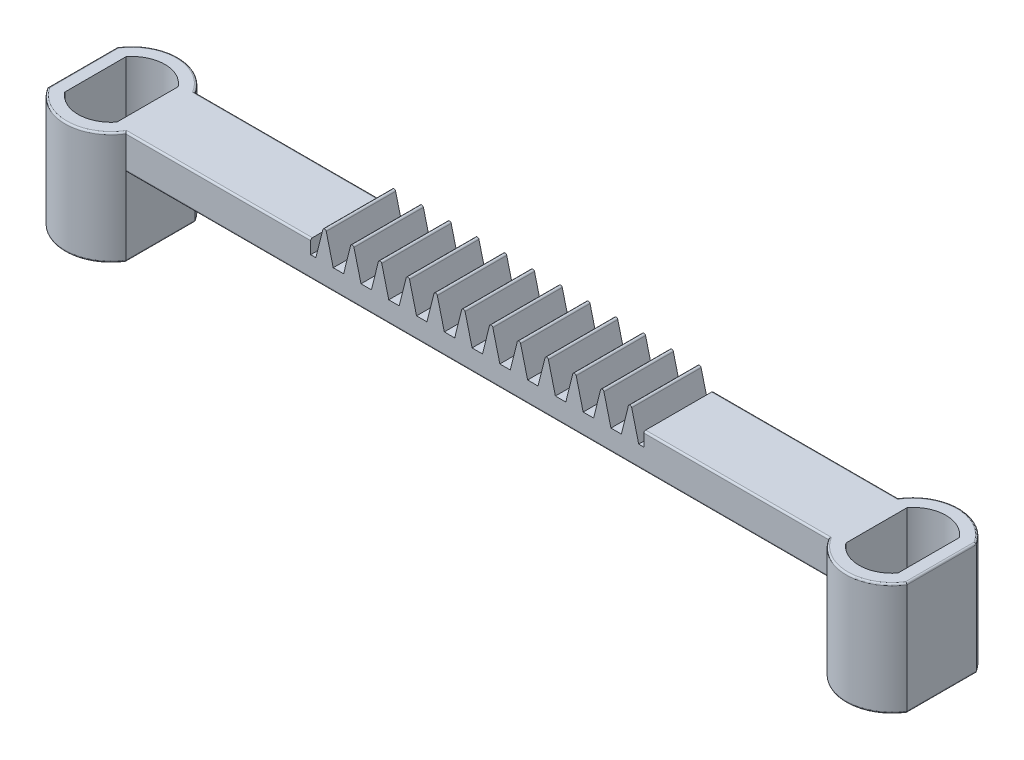
from build123d import *

# Parameters (mm, degrees)
SKETCH_1_W                     = 42
SKETCH_1_H                     = 4
EXTRUDE_1_DEPTH                = 2
EXTRUDE_2_DEPTH                = 6.5
CUT_EXTRUDE_1_DEPTH            = 5
CUT_EXTRUDE_2_DEPTH            = 1.5
CUT_EXTRUDE_3_REACH            = 27.698
SKETCH_5_W                     = 19.2
SKETCH_5_H                     = 0.8
EXTRUDE_3_DEPTH                = 4
FILLET_1_R                     = 0.1
PATTERN_LINEAR_1_COUNT         = 12
PATTERN_LINEAR_1_PITCH         = 1.6
FILLET_1_OF_PATTERN_LINEAR_1_R = 0.1
FILLET_2_R                     = 0.1


with BuildPart() as part:
    # 草图1 → 凸台-拉伸1 (new body)
    with BuildSketch(Plane(origin=(0, 0, 0), x_dir=(1, 0, 0), z_dir=(0, 1, 0))):
        Rectangle(SKETCH_1_W, SKETCH_1_H)
    extrude(amount=EXTRUDE_1_DEPTH)

    # 草图2 → 凸台-拉伸2 (add)
    with BuildSketch(Plane(origin=(0, 2, 0), x_dir=(1, 0, 0), z_dir=(0, 1, 0))):
        with BuildLine():
            Line((20.25, 2), (20.25, -2))
            ThreePointArc((20.25, -2), (22.5, -3.25), (24.75, -2))
            Line((24.75, -2), (24.75, 2))
            ThreePointArc((24.75, 2), (22.5, 3.25), (20.25, 2))
        make_face()
    extrude_2 = extrude(amount=-EXTRUDE_2_DEPTH)

    # 草图3 → 切除-拉伸1 (cut)
    with BuildSketch(Plane(origin=(0, 2, 0), x_dir=(1, 0, 0), z_dir=(0, 1, 0))):
        with BuildLine():
            Line((21, 1.766190379), (21, -1.766190379))
            ThreePointArc((21, -1.766190379), (22.5, -2.5), (24, -1.766190379))
            Line((24, -1.766190379), (24, 1.766190379))
            ThreePointArc((24, 1.766190379), (22.5, 2.5), (21, 1.766190379))
        make_face()
    cut_extrude_1 = extrude(amount=-CUT_EXTRUDE_1_DEPTH, mode=Mode.SUBTRACT)

    # 草图4 → 切除-拉伸2 (cut)
    with BuildSketch(Plane.XZ.offset(4.5)):
        with BuildLine():
            Line((23.75, -1.677032961), (23.75, 1.677032961))
            ThreePointArc((23.75, 1.677032961), (22.5, 2.25), (21.25, 1.677032961))
            Line((21.25, 1.677032961), (21.25, -1.677032961))
            ThreePointArc((21.25, -1.677032961), (22.5, -2.25), (23.75, -1.677032961))
        make_face()
    cut_extrude_2 = extrude(amount=-CUT_EXTRUDE_2_DEPTH, mode=Mode.SUBTRACT)

    # 镜向1: 凸台-拉伸2, 切除-拉伸1, 切除-拉伸2 across plane
    add(extrude_2.mirror(Plane(origin=(0, 0, 0), x_dir=(0, 0, 1), z_dir=(1, 0, 0))))
    add(cut_extrude_1.mirror(Plane(origin=(0, 0, 0), x_dir=(0, 0, 1), z_dir=(1, 0, 0))), mode=Mode.SUBTRACT)
    add(cut_extrude_2.mirror(Plane(origin=(0, 0, 0), x_dir=(0, 0, 1), z_dir=(1, 0, 0))), mode=Mode.SUBTRACT)

    # 草图5 → 切除-拉伸3 (cut, up to next)
    with BuildSketch(Plane.XY.offset(2), mode=Mode.PRIVATE) as cut_extrude_3_sk1:
        with Locations((0, 1.6)):
            Rectangle(SKETCH_5_W, SKETCH_5_H)
    cut_extrude_3_tool1 = extrude(cut_extrude_3_sk1.sketch, amount=-CUT_EXTRUDE_3_REACH, mode=Mode.PRIVATE) & part.part
    add(cut_extrude_3_tool1.solids().sort_by_distance((0, 1.6, 2))[0], mode=Mode.SUBTRACT)

    # 草图6 → 凸台-拉伸3 (add)
    with BuildSketch(Plane.XY.offset(2)):
        Polygon((-9.3, 1.2), (-8.3, 1.2), (-8.8, 3.2), align=None)
    extrude_3 = extrude(amount=-EXTRUDE_3_DEPTH)

    # 圆角1
    fillet_1_edges = [part.edges().sort_by_distance(p)[0] for p in [
        (-8.8, 3.2, 0),
    ]]
    fillet(fillet_1_edges, radius=FILLET_1_R)

    # 阵列(线性)1: 凸台-拉伸3 ×12
    with Locations(*[(i * PATTERN_LINEAR_1_PITCH, 0, 0) for i in range(1, PATTERN_LINEAR_1_COUNT)]):
        add(extrude_3)

    # 圆角1 of 阵列(线性)1
    fillet_1_of_pattern_linear_1_edges = [part.edges().sort_by_distance(p)[0] for p in [
        (-7.2, 3.2, 0),
        (-5.6, 3.2, 0),
        (-4, 3.2, 0),
        (-2.4, 3.2, 0),
        (-0.8, 3.2, 0),
        (0.8, 3.2, 0),
        (2.4, 3.2, 0),
        (4, 3.2, 0),
        (5.6, 3.2, 0),
        (7.2, 3.2, 0),
        (8.8, 3.2, 0),
    ]]
    fillet(fillet_1_of_pattern_linear_1_edges, radius=FILLET_1_OF_PATTERN_LINEAR_1_R)

    # 圆角2
    fillet_2_edges = [part.edges().sort_by_distance(p)[0] for p in [
        (14.925, 2, 2),
        (-14.925, 2, -2),
        (0, 0, -2),
        (14.925, 2, -2),
        (22.5, 2, 3.25),
        (24.75, 2, 0),
        (22.5, 2, -3.25),
        (20.25, -4.5, 0),
        (22.5, -4.5, -3.25),
        (24.75, -4.5, 0),
        (22.5, -4.5, 3.25),
        (0, 0, 2),
        (-14.925, 2, 2),
        (-22.5, 2, -3.25),
        (-22.5, 2, 3.25),
        (-24.75, 2, 0),
        (-22.5, -4.5, -3.25),
        (-20.25, -4.5, 0),
        (-22.5, -4.5, 3.25),
        (-24.75, -4.5, 0),
    ]]
    fillet(fillet_2_edges, radius=FILLET_2_R)


solid = part.part
